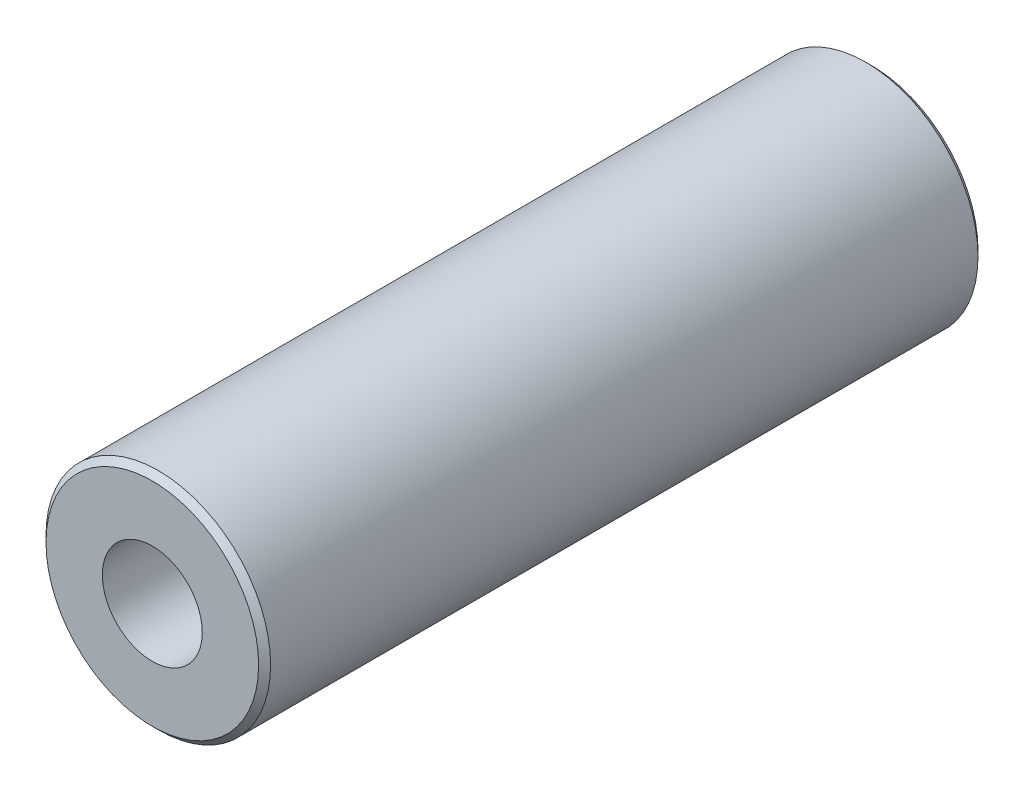
from build123d import *

# Parameters (mm, degrees)
BASE_SKETCH_R      = 7.1374
BASE_SKETCH_R_2    = 3.175
BASE_EXTRUDE_DEPTH = 45.72
END_CHAMFER_SIZE   = 0.381


with BuildPart() as part:
    # Base Sketch → Base Extrude (new body)
    with BuildSketch(Plane.XY):
        Circle(BASE_SKETCH_R)
        Circle(BASE_SKETCH_R_2, mode=Mode.SUBTRACT)
    extrude(amount=-BASE_EXTRUDE_DEPTH)

    # End Chamfer
    end_chamfer_edges = [part.edges().sort_by_distance(p)[0] for p in [
        (-7.1374, 0, 0),
        (-7.1374, 0, -45.72),
    ]]
    chamfer(end_chamfer_edges, length=END_CHAMFER_SIZE)


solid = part.part
